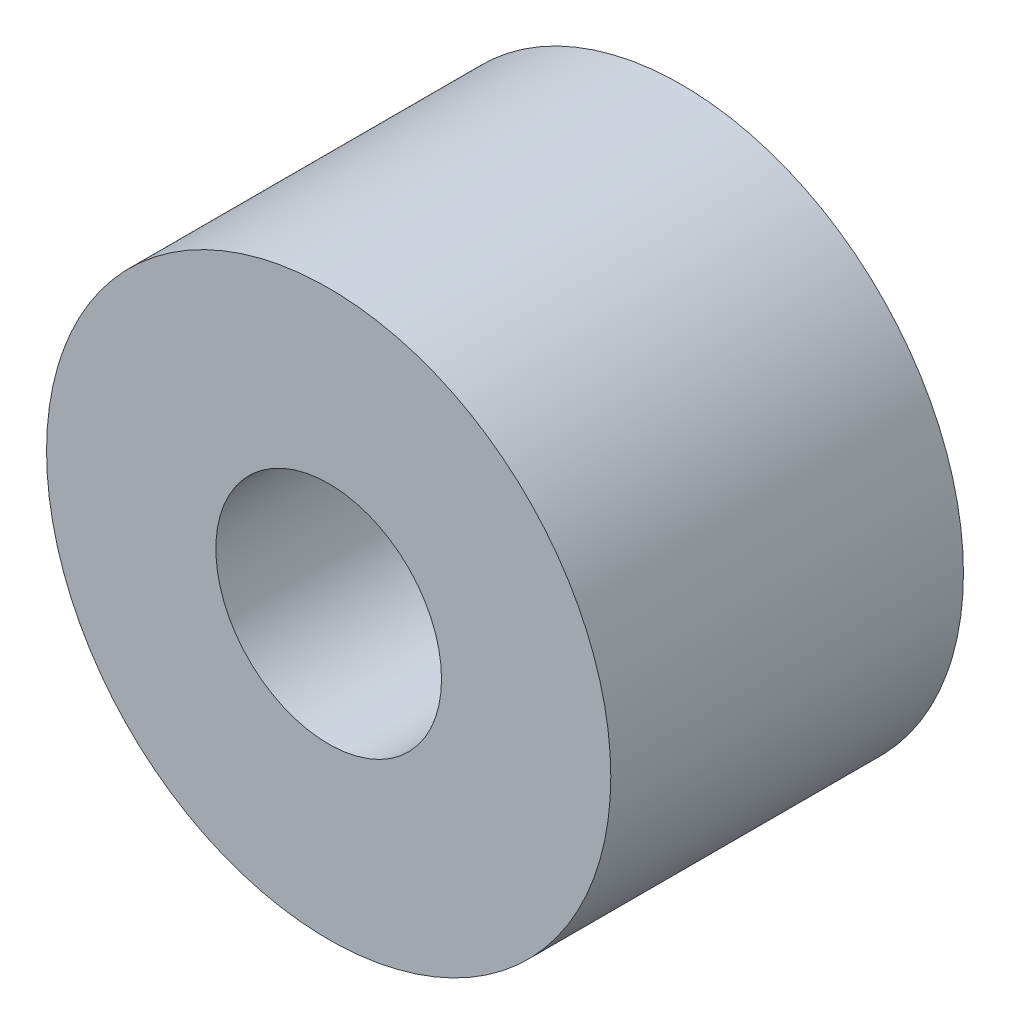
from build123d import *

# Parameters (mm, degrees)
EXTRUDE1_DEPTH      = 2.5
EXTRUDE1_DEPTH_BACK = 2.5
SKETCH1_R           = 4
SKETCH1_R_2         = 1.6


with BuildPart() as part:
    # Sketch1 → Extrude1 (new, two sides: drawn at the far end of the back side and taken through both)
    with BuildSketch(Plane.XY.offset(-EXTRUDE1_DEPTH_BACK)):
        Circle(SKETCH1_R)
        Circle(SKETCH1_R_2, mode=Mode.SUBTRACT)
    extrude(amount=EXTRUDE1_DEPTH + EXTRUDE1_DEPTH_BACK)


solid = part.part
